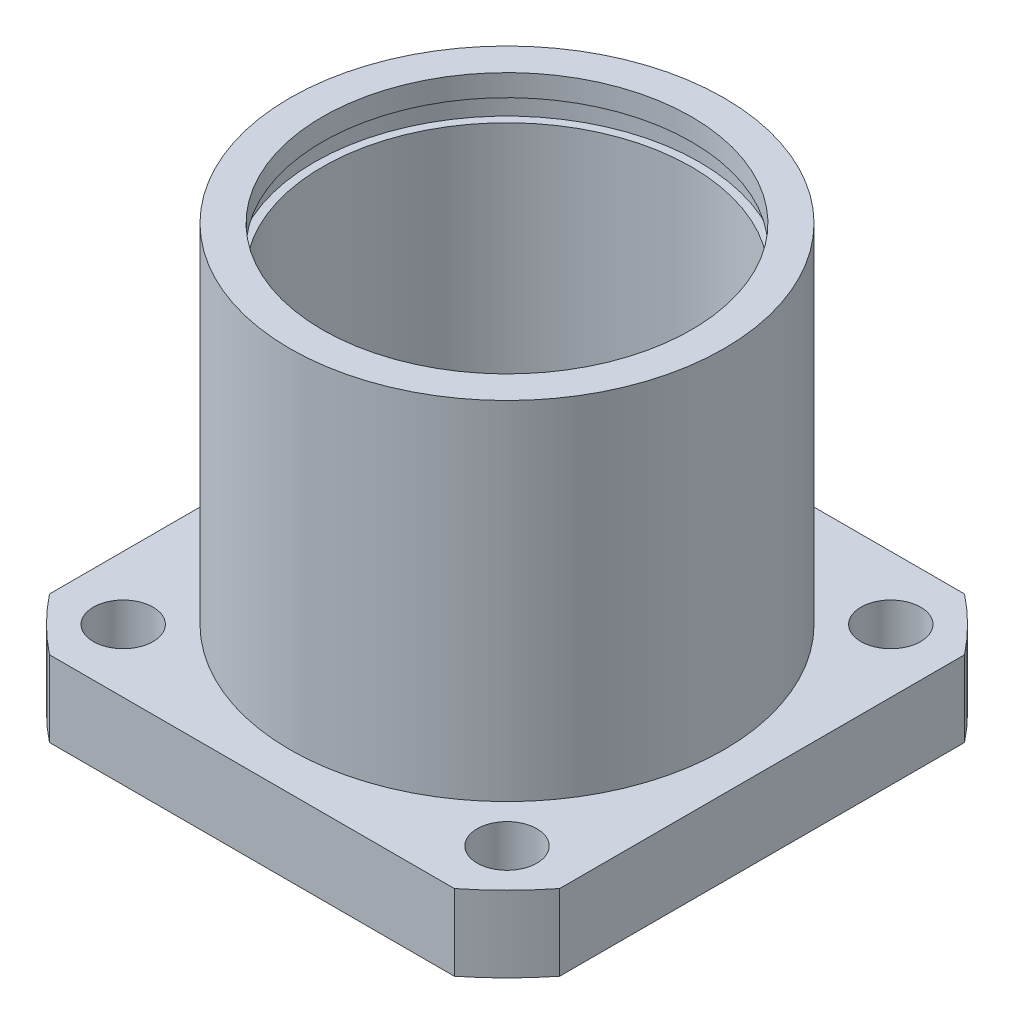
from build123d import *

# Parameters (mm, degrees)
SKETCH_4_R           = 2.75
CUT_EXTRUDE_1_DEPTH  = 54.141321022
SKETCH_5_OUTSIDE_W   = 80.762
SKETCH_5_OUTSIDE_H   = 80.762
SKETCH_5_OUTSIDE_W_2 = 47
SKETCH_5_OUTSIDE_H_2 = 47
CUT_EXTRUDE_2_DEPTH  = 54.141321022


with BuildPart() as part:
    # Эскиз1 → Повернуть1 (revolve)
    with BuildSketch(Plane.XY):
        Polygon((-17, 0), (-21.5, 0), (-21.5, 1), (-30, 1), (-30, 8), (-20, 8), (-20, 40), (-17, 40), (-17, 38), (-17.75, 38), (-17.75, 36), (-17, 36), (-17, 4), (-17.75, 4), (-17.75, 2), (-17, 2), align=None)
    revolve(axis=Axis((0, 50.260536223, 0), (0, -1, 0)))

    # Эскиз4 → Вырез-Вытянуть1 (cut, through all)
    with BuildSketch(Plane(origin=(0, 8, 0), x_dir=(1, 0, 0), z_dir=(0, 1, 0))):
        with Locations((-17.67766953, 17.67766953)):
            Circle(SKETCH_4_R)
        with Locations((-17.67766953, -17.67766953)):
            Circle(SKETCH_4_R)
        with Locations((17.67766953, 17.67766953)):
            Circle(SKETCH_4_R)
        with Locations((17.67766953, -17.67766953)):
            Circle(SKETCH_4_R)
    extrude(amount=-CUT_EXTRUDE_1_DEPTH, mode=Mode.SUBTRACT)

    # Эскиз5 outside → Вырез-Вытянуть2 (cut, through all)
    with BuildSketch(Plane(origin=(0, 8, 0), x_dir=(1, 0, 0), z_dir=(0, 1, 0))):
        Rectangle(SKETCH_5_OUTSIDE_W, SKETCH_5_OUTSIDE_H)
        Rectangle(SKETCH_5_OUTSIDE_W_2, SKETCH_5_OUTSIDE_H_2, mode=Mode.SUBTRACT)
    extrude(amount=-CUT_EXTRUDE_2_DEPTH, mode=Mode.SUBTRACT)


solid = part.part
